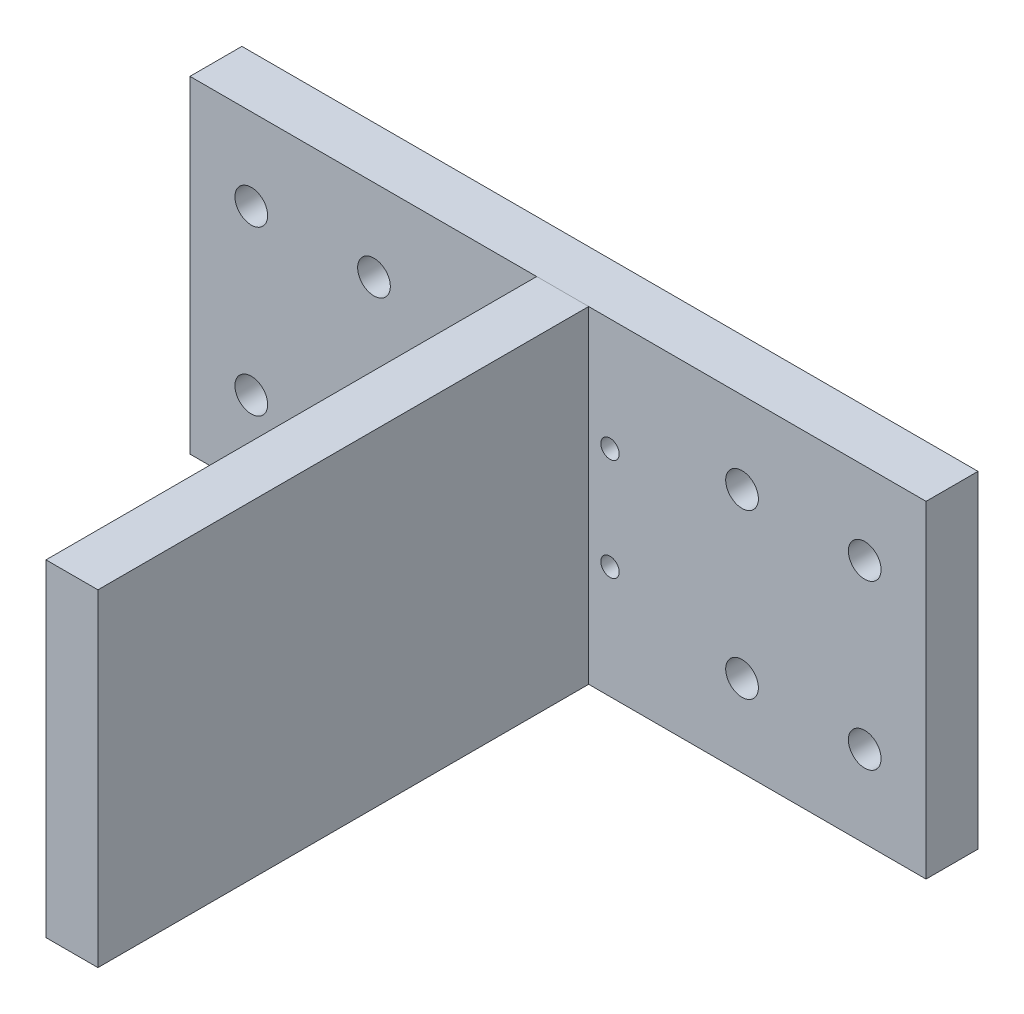
from build123d import *

# Parameters (mm, degrees)
CROQUIS1_W              = 180
CROQUIS1_H              = 80
CROQUIS1_R              = 4
CROQUIS1_R_2            = 2.25
SALIENTE_EXTRUIR1_DEPTH = 12.7
CROQUIS2_W              = 12.7
CROQUIS2_H              = 80.011204884
SALIENTE_EXTRUIR2_DEPTH = 120


with BuildPart() as part:
    # Croquis1 → Saliente-Extruir1 (new body)
    with BuildSketch(Plane.XY):
        with Locations((-60, 40)):
            Rectangle(CROQUIS1_W, CROQUIS1_H)
        with Locations((15, 20)):
            Circle(CROQUIS1_R, mode=Mode.SUBTRACT)
        with Locations((-15, 20)):
            Circle(CROQUIS1_R, mode=Mode.SUBTRACT)
        with Locations((15, 60)):
            Circle(CROQUIS1_R, mode=Mode.SUBTRACT)
        with Locations((-15, 60)):
            Circle(CROQUIS1_R, mode=Mode.SUBTRACT)
        with Locations((-105, 20)):
            Circle(CROQUIS1_R, mode=Mode.SUBTRACT)
        with Locations((-135, 20)):
            Circle(CROQUIS1_R, mode=Mode.SUBTRACT)
        with Locations((-135, 60)):
            Circle(CROQUIS1_R, mode=Mode.SUBTRACT)
        with Locations((-105, 60)):
            Circle(CROQUIS1_R, mode=Mode.SUBTRACT)
        with Locations((-72.288485416, 27.5)):
            Circle(CROQUIS1_R_2, mode=Mode.SUBTRACT)
        with Locations((-72.288485416, 52.5)):
            Circle(CROQUIS1_R_2, mode=Mode.SUBTRACT)
        with Locations((-47.288485416, 52.5)):
            Circle(CROQUIS1_R_2, mode=Mode.SUBTRACT)
        with Locations((-47.288485416, 27.5)):
            Circle(CROQUIS1_R_2, mode=Mode.SUBTRACT)
    extrude(amount=SALIENTE_EXTRUIR1_DEPTH)

    # Croquis2 → Saliente-Extruir2 (add)
    with BuildSketch(Plane.XY.offset(12.7)):
        with Locations((-58.85, 40.005602442)):
            Rectangle(CROQUIS2_W, CROQUIS2_H)
    extrude(amount=SALIENTE_EXTRUIR2_DEPTH)


solid = part.part
